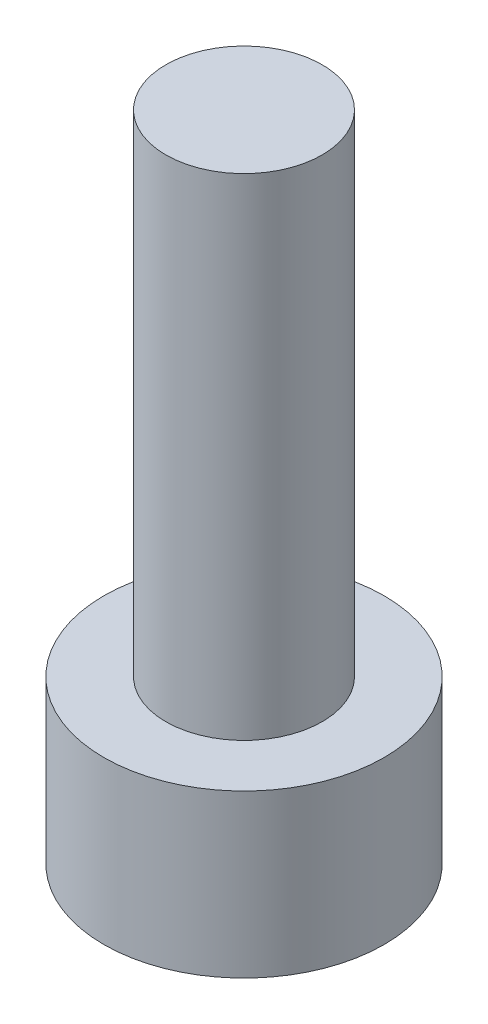
from build123d import *

# Parameters (mm, degrees)
SKETCH1_R           = 1.73
BOSS_EXTRUDE1_DEPTH = 2
SKETCH2_R           = 0.965
BOSS_EXTRUDE2_DEPTH = 6.06


with BuildPart() as part:
    # Sketch1 → Boss-Extrude1 (new body)
    with BuildSketch(Plane(origin=(0, 0, 0), x_dir=(1, 0, 0), z_dir=(0, 1, 0))):
        with Locations(Location((0, 0, 0), (0, 0, 270))):
            Circle(SKETCH1_R)
    extrude(amount=BOSS_EXTRUDE1_DEPTH)

    # Sketch2 → Boss-Extrude2 (add)
    with BuildSketch(Plane(origin=(0, 2, 0), x_dir=(1, 0, 0), z_dir=(0, 1, 0))):
        with Locations(Location((0, 0, 0), (0, 0, 270))):
            Circle(SKETCH2_R)
    extrude(amount=BOSS_EXTRUDE2_DEPTH)


solid = part.part
